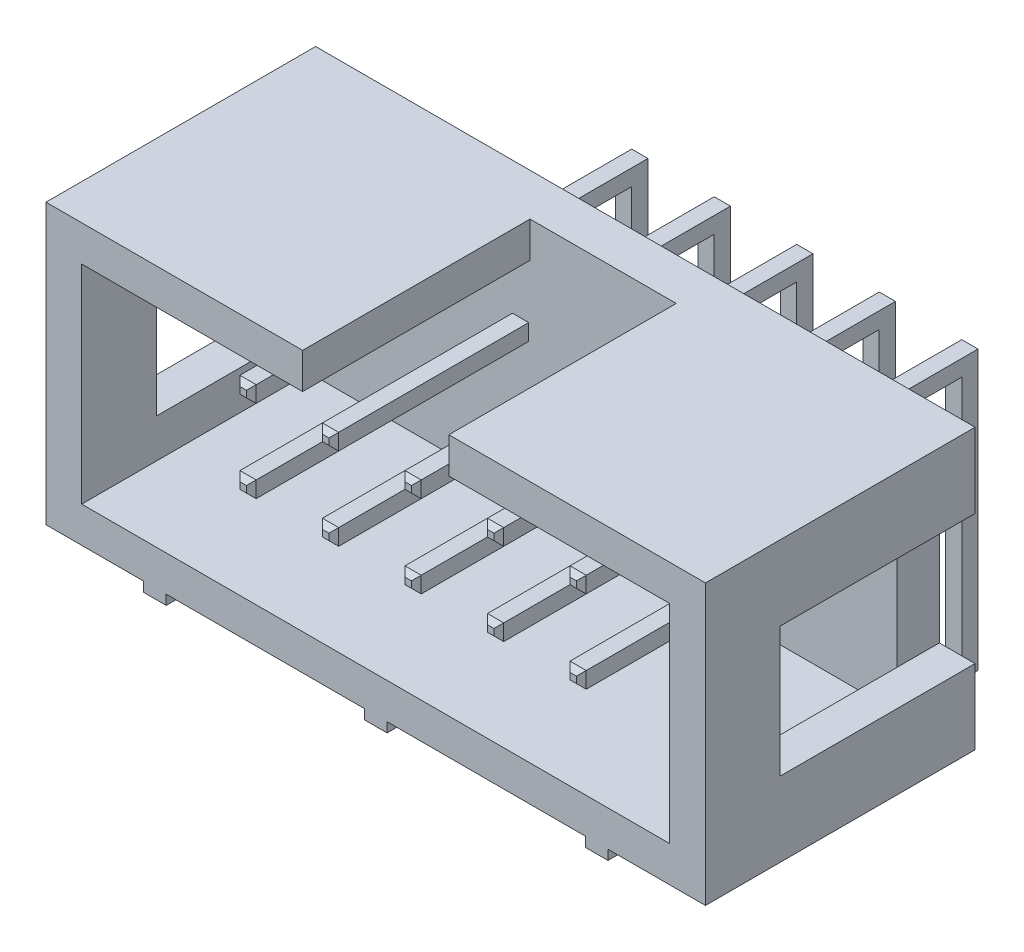
from build123d import *

# Parameters (mm, degrees)
SKICA1_W                  = 20.3
SKICA1_H                  = 8.6
P_IDAT_VYSUNUT_M1_DEPTH   = 8.3
SKICA2_W                  = 18.1
SKICA2_H                  = 6.4
ODEBRAT_VYSUNUT_M1_DEPTH  = 7
ODEBRAT_VYSUNUT_M3_REACH  = 17.68
SKICA3_W                  = 4.5
SKICA3_H                  = 7
ODEBRAT_START             = -1.1
SKICA4_W                  = 6
SKICA4_H                  = 4
ODEBRAT_VYSUNUT_M4_DEPTH  = 1.1
SKICA5_W                  = 0.7
SKICA5_H                  = 8.3
P_IDAT_VYSUNUT_M2_DEPTH   = 0.3
P_IDAT_VYSUNUT_M3_DEPTH   = 0.25
P_IDAT_VYSUNUT_M3_2_DEPTH = 0.25
ZKOSEN_1_SIZE             = 0.15
ZKOSEN_2_SIZE             = 0.15
LINPOLE1_COUNT            = 5
LINPOLE1_PITCH            = 2.54


with BuildPart() as part:
    # Skica1 → Přidat vysunutím1 (new body)
    with BuildSketch(Plane.XY):
        Rectangle(SKICA1_W, SKICA1_H)
    extrude(amount=P_IDAT_VYSUNUT_M1_DEPTH)

    # Skica2 → Odebrat vysunutím1 (cut)
    with BuildSketch(Plane.XY.offset(8.3)):
        Rectangle(SKICA2_W, SKICA2_H)
    extrude(amount=-ODEBRAT_VYSUNUT_M1_DEPTH, mode=Mode.SUBTRACT)

    # Skica3 → Odebrat vysunutím3 (cut, up to next)
    with BuildSketch(Plane(origin=(0, 4.3, 0), x_dir=(1, 0, 0), z_dir=(0, 1, 0)), mode=Mode.PRIVATE) as odebrat_vysunut_m3_sk1:
        with Locations((0, -4.8)):
            Rectangle(SKICA3_W, SKICA3_H)
    odebrat_vysunut_m3_tool1 = extrude(odebrat_vysunut_m3_sk1.sketch, amount=-ODEBRAT_VYSUNUT_M3_REACH, mode=Mode.PRIVATE) & part.part
    add(odebrat_vysunut_m3_tool1.solids().sort_by_distance((0, 4.3, 4.8))[0], mode=Mode.SUBTRACT)

    # Skica4 → Odebrat vysunutím4 (cut)
    with BuildSketch(Plane(origin=(10.15, 0, 0), x_dir=(0, 0, -1), z_dir=(1, 0, 0)).offset(ODEBRAT_START)):
        with Locations((-3, 0)):
            Rectangle(SKICA4_W, SKICA4_H)
    odebrat_vysunut_m4 = extrude(amount=ODEBRAT_VYSUNUT_M4_DEPTH, mode=Mode.SUBTRACT)

    # Zrcadlit2: Odebrat vysunutím4 across plane
    add(odebrat_vysunut_m4.mirror(Plane(origin=(0, 0, 0), x_dir=(0, 0, 1), z_dir=(1, 0, 0))), mode=Mode.SUBTRACT)

    # Skica5 → Přidat vysunutím2 (add)
    with BuildSketch(Plane.XZ.offset(4.3)):
        with Locations((-6.8, 4.15)):
            Rectangle(SKICA5_W, SKICA5_H)
        with Locations((0, 4.15)):
            Rectangle(SKICA5_W, SKICA5_H)
        with Locations((6.8, 4.15)):
            Rectangle(SKICA5_W, SKICA5_H)
    extrude(amount=P_IDAT_VYSUNUT_M2_DEPTH)


with BuildPart() as body_2:
    # Skica6 → Přidat vysunutím3 (new, symmetric)
    with BuildSketch(Plane(origin=(5.08, 0, 0), x_dir=(0, 0, -1), z_dir=(1, 0, 0))):
        Polygon((-7.3, 1.02), (4.41, 1.02), (4.41, -7.2), (4.91, -7.2), (4.91, 1.52), (-7.3, 1.52), align=None)
    extrude(amount=P_IDAT_VYSUNUT_M3_DEPTH, both=True)

    # Zkosení1
    zkosen_1_edges = [body_2.edges().sort_by_distance(p)[0] for p in [
        (5.08, 1.52, 7.3),
        (5.08, -7.2, -4.91),
        (5.08, -7.2, -4.41),
        (5.08, 1.02, 7.3),
        (5.33, -7.2, -4.66),
        (5.33, 1.27, 7.3),
        (4.83, -7.2, -4.66),
        (4.83, 1.27, 7.3),
    ]]
    chamfer(zkosen_1_edges, length=ZKOSEN_1_SIZE)


with BuildPart() as body_3:
    # Skica6 → P_idat vysunut_m3 2 (new, symmetric)
    with BuildSketch(Plane(origin=(5.08, 0, 0), x_dir=(0, 0, -1), z_dir=(1, 0, 0))):
        Polygon((-7.3, -1.52), (1.87, -1.52), (1.87, -7.2), (2.37, -7.2), (2.37, -1.02), (-7.3, -1.02), align=None)
    extrude(amount=P_IDAT_VYSUNUT_M3_2_DEPTH, both=True)

    # Zkosení2
    zkosen_2_edges = [body_3.edges().sort_by_distance(p)[0] for p in [
        (5.08, -1.02, 7.3),
        (5.08, -7.2, -2.37),
        (5.08, -7.2, -1.87),
        (5.08, -1.52, 7.3),
        (5.33, -7.2, -2.12),
        (5.33, -1.27, 7.3),
        (4.83, -7.2, -2.12),
        (4.83, -1.27, 7.3),
    ]]
    chamfer(zkosen_2_edges, length=ZKOSEN_2_SIZE)


with BuildPart() as linpole1_1:
    # LinPole1: pattern copy
    add(body_3.part.moved(Location(Vector(-1, 0, 0) * (1 * LINPOLE1_PITCH))))


with BuildPart() as linpole1_2:
    # LinPole1: pattern copy
    add(body_3.part.moved(Location(Vector(-1, 0, 0) * (2 * LINPOLE1_PITCH))))


with BuildPart() as linpole1_3:
    # LinPole1: pattern copy
    add(body_3.part.moved(Location(Vector(-1, 0, 0) * (3 * LINPOLE1_PITCH))))


with BuildPart() as linpole1_4:
    # LinPole1: pattern copy
    add(body_3.part.moved(Location(Vector(-1, 0, 0) * (4 * LINPOLE1_PITCH))))


with BuildPart() as linpole1_5:
    # LinPole1: pattern copy
    add(body_2.part.moved(Location(Vector(-1, 0, 0) * (1 * LINPOLE1_PITCH))))


with BuildPart() as linpole1_6:
    # LinPole1: pattern copy
    add(body_2.part.moved(Location(Vector(-1, 0, 0) * (2 * LINPOLE1_PITCH))))


with BuildPart() as linpole1_7:
    # LinPole1: pattern copy
    add(body_2.part.moved(Location(Vector(-1, 0, 0) * (3 * LINPOLE1_PITCH))))


with BuildPart() as linpole1_8:
    # LinPole1: pattern copy
    add(body_2.part.moved(Location(Vector(-1, 0, 0) * (4 * LINPOLE1_PITCH))))


solid = Compound([part.part, body_2.part, body_3.part, linpole1_1.part, linpole1_2.part, linpole1_3.part, linpole1_4.part, linpole1_5.part, linpole1_6.part, linpole1_7.part, linpole1_8.part])
